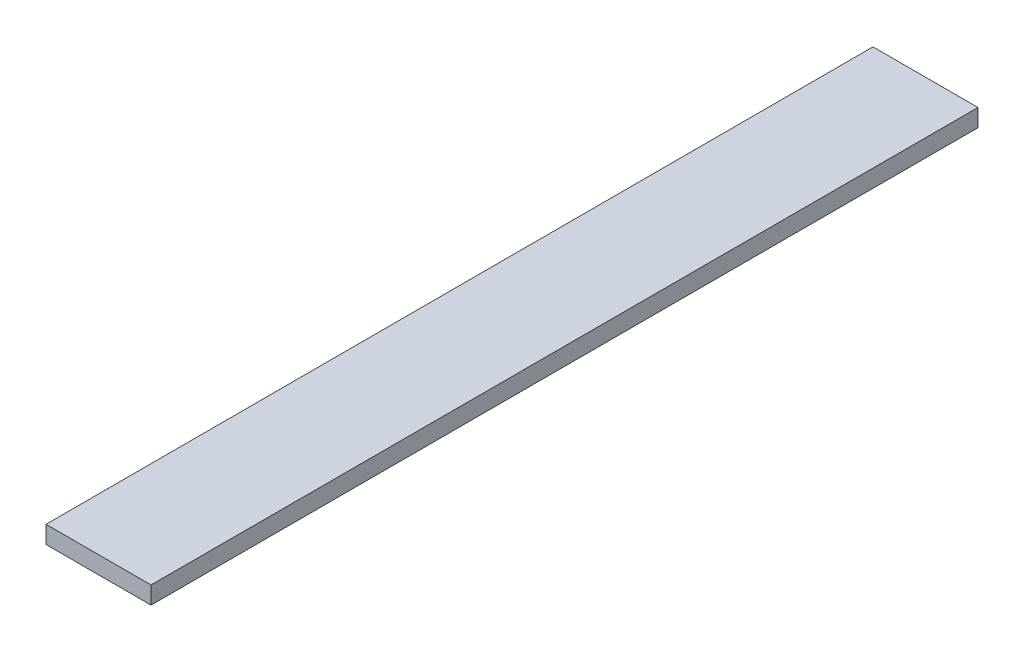
from build123d import *

# Parameters (mm, degrees)
SKETCH1_W           = 76.2
SKETCH1_H           = 12.7
BOSS_EXTRUDE1_DEPTH = 600


with BuildPart() as part:
    # Sketch1 → Boss-Extrude1 (new body)
    with BuildSketch(Plane.XY):
        Rectangle(SKETCH1_W, SKETCH1_H)
    extrude(amount=BOSS_EXTRUDE1_DEPTH)


solid = part.part
